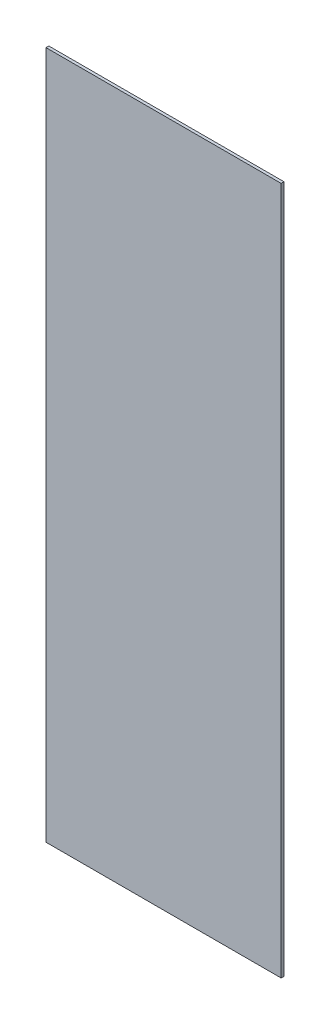
from build123d import *

# Parameters (mm, degrees)
SKETCH1_W           = 83
SKETCH1_H           = 243
BOSS_EXTRUDE1_DEPTH = 1


with BuildPart() as part:
    # Sketch1 → Boss-Extrude1 (new body)
    with BuildSketch(Plane.XY):
        with Locations((41.5, 121.5)):
            Rectangle(SKETCH1_W, SKETCH1_H)
    extrude(amount=BOSS_EXTRUDE1_DEPTH)


solid = part.part
